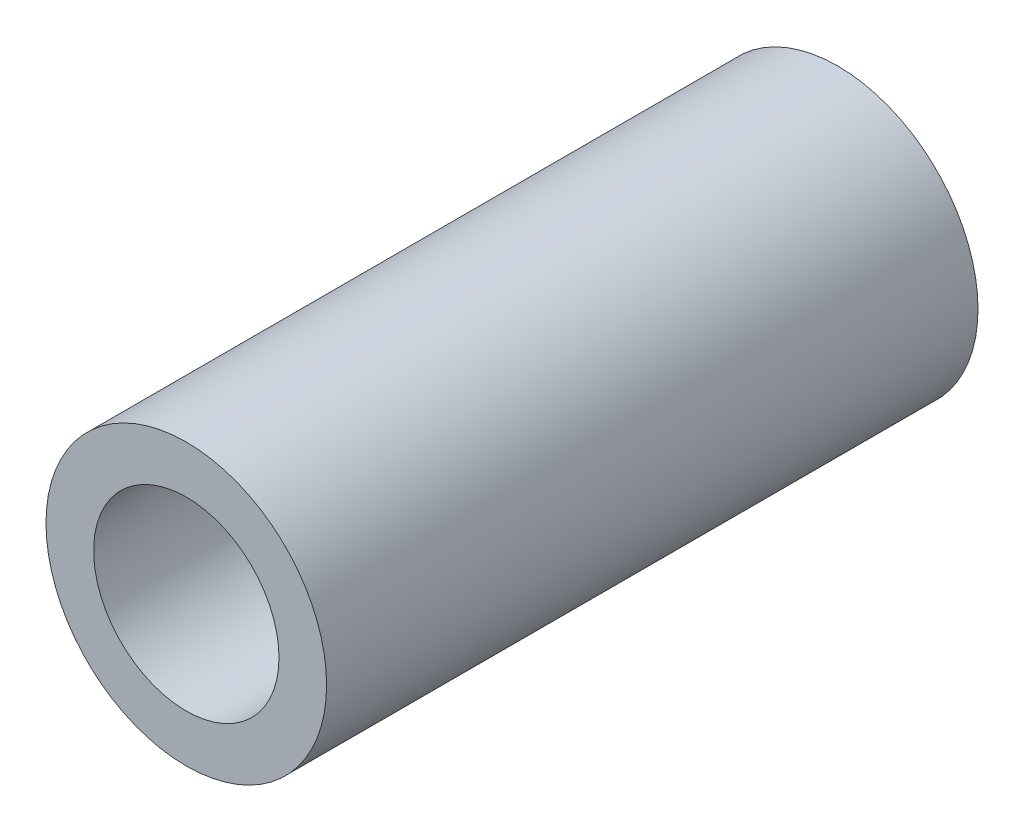
from build123d import *

# Parameters (mm, degrees)
SKETCH1_R           = 14
BOSS_EXTRUDE3_DEPTH = 65
SKETCH2_R           = 9.25
CUT_EXTRUDE1_DEPTH  = 65


with BuildPart() as part:
    # Sketch1 → Boss-Extrude3 (new body)
    with BuildSketch(Plane.XY):
        with Locations((-23.764277035, 16.804738761)):
            Circle(SKETCH1_R)
    extrude(amount=BOSS_EXTRUDE3_DEPTH)

    # Sketch2 → Cut-Extrude1 (cut)
    with BuildSketch(Plane.XY):
        with Locations((-23.764277035, 16.804738761)):
            Circle(SKETCH2_R)
    extrude(amount=CUT_EXTRUDE1_DEPTH, mode=Mode.SUBTRACT)


solid = part.part
